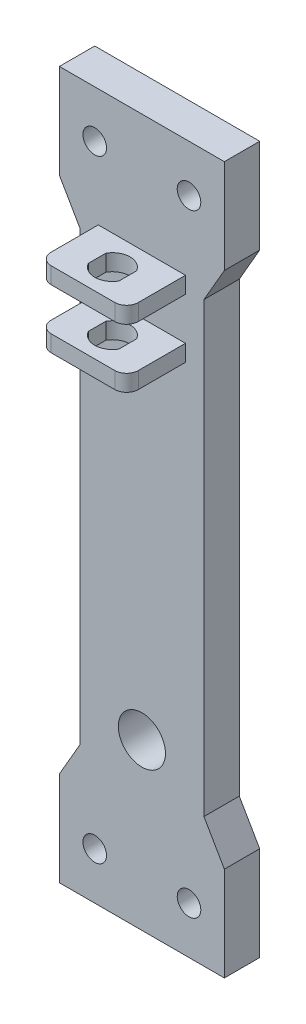
from build123d import *

# Parameters (mm, degrees)
BOSS_EXTRUDE1_DEPTH = 15
SKETCH3_R           = 5
CUT_EXTRUDE1_DEPTH  = 155.757875405
SKETCH4_R           = 10
CUT_EXTRUDE2_DEPTH  = 155.757875405
SKETCH6_W           = 37
SKETCH6_H           = 7
BOSS_EXTRUDE2_DEPTH = 25
CUT_EXTRUDE3_DEPTH  = 32
FILLET3_R           = 5


with BuildPart() as part:
    # Sketch2 → Boss-Extrude1 (new body)
    with BuildSketch(Plane.XY):
        Polygon((-35, 110), (-26.339745962, 95), (-26.339745962, -95), (-35, -110), (-35, -150), (35, -150), (35, -110), (26.339745962, -95), (26.339745962, 95), (35, 110), (35, 150), (-35, 150), align=None)
    extrude(amount=BOSS_EXTRUDE1_DEPTH)

    # Sketch3 → Cut-Extrude1 (cut, through all)
    with BuildSketch(Plane.XY.offset(15)):
        with Locations((-20, 130)):
            Circle(SKETCH3_R)
        with Locations((20, 130)):
            Circle(SKETCH3_R)
        with Locations(Location((20, -130, 0), (0, 0, 180))):
            Circle(SKETCH3_R)
        with Locations(Location((-20, -130, 0), (0, 0, 180))):
            Circle(SKETCH3_R)
    extrude(amount=-CUT_EXTRUDE1_DEPTH, mode=Mode.SUBTRACT)

    # Sketch4 → Cut-Extrude2 (cut, through all)
    with BuildSketch(Plane.XY.offset(15)):
        with Locations((0, -80)):
            Circle(SKETCH4_R)
    extrude(amount=-CUT_EXTRUDE2_DEPTH, mode=Mode.SUBTRACT)

    # Sketch6 → Boss-Extrude2 (add)
    with BuildSketch(Plane.XY.offset(15)):
        with Locations((0, 96.5)):
            Rectangle(SKETCH6_W, SKETCH6_H)
        with Locations((0, 71.5)):
            Rectangle(SKETCH6_W, SKETCH6_H)
    extrude(amount=BOSS_EXTRUDE2_DEPTH)

    # Sketch7 → Cut-Extrude3 (cut)
    with BuildSketch(Plane.XZ.offset(-68)):
        with BuildLine():
            Line((-6.5, 31.241657387), (-6.5, 23.758342613))
            ThreePointArc((-6.5, 23.758342613), (0, 20), (6.5, 23.758342613))
            Line((6.5, 23.758342613), (6.5, 31.241657387))
            ThreePointArc((6.5, 31.241657387), (0, 35), (-6.5, 31.241657387))
        make_face()
    extrude(amount=-CUT_EXTRUDE3_DEPTH, mode=Mode.SUBTRACT)

    # Fillet3
    fillet3_edges = [part.edges().sort_by_distance(p)[0] for p in [
        (18.5, 96.5, 40),
        (-18.5, 96.5, 40),
        (18.5, 71.5, 40),
        (-18.5, 71.5, 40),
    ]]
    fillet(fillet3_edges, radius=FILLET3_R)


solid = part.part
